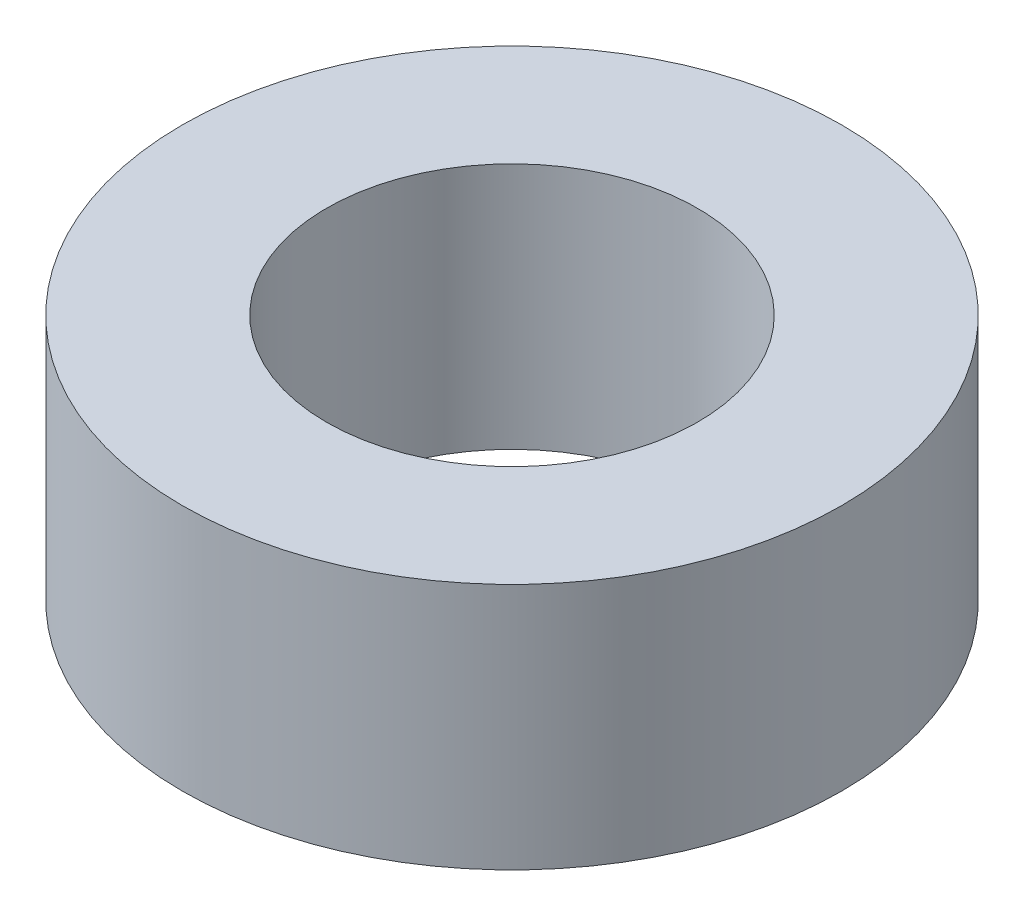
from build123d import *

# Parameters (mm, degrees)
SKETCH_1_R      = 4
SKETCH_1_R_2    = 2.25
EXTRUDE_1_DEPTH = 3


with BuildPart() as part:
    # Эскиз1 → Бобышка-Вытянуть1 (new body)
    with BuildSketch(Plane(origin=(0, 0, 0), x_dir=(1, 0, 0), z_dir=(0, 1, 0))):
        with Locations(Location((0, 0, 0), (0, 0, 270))):
            Circle(SKETCH_1_R)
        with Locations(Location((0, 0, 0), (0, 0, 270))):
            Circle(SKETCH_1_R_2, mode=Mode.SUBTRACT)
    extrude(amount=EXTRUDE_1_DEPTH)


solid = part.part
